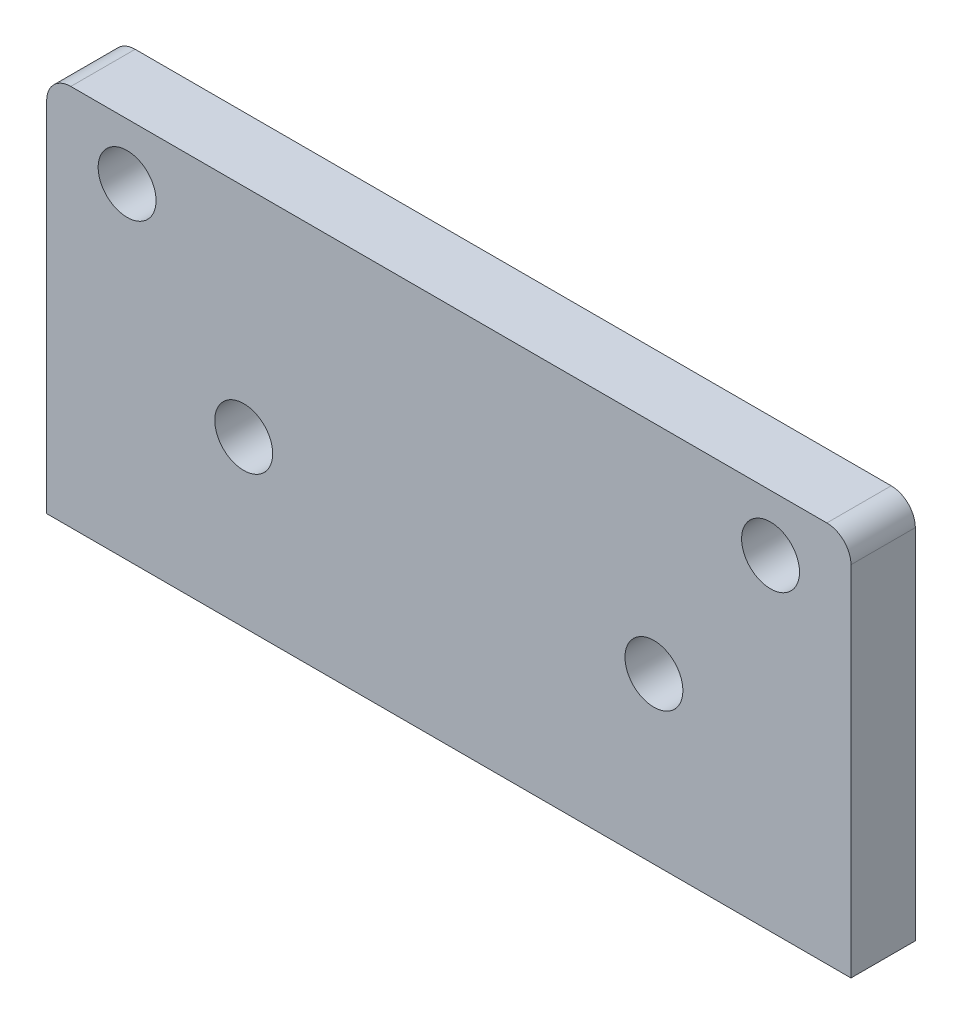
from build123d import *

# Parameters (mm, degrees)
SKETCH1_W           = 50
SKETCH1_H           = 23.75
BOSS_EXTRUDE1_DEPTH = 4
FILLET1_R           = 1.5
SKETCH2_R           = 1.8
CUT_EXTRUDE1_DEPTH  = 28.964542281


with BuildPart() as part:
    # Sketch1 → Boss-Extrude1 (new body)
    with BuildSketch(Plane.XY):
        Rectangle(SKETCH1_W, SKETCH1_H)
    extrude(amount=BOSS_EXTRUDE1_DEPTH)

    # Fillet1
    fillet1_edges = [part.edges().sort_by_distance(p)[0] for p in [
        (-25, 11.875, 2),
        (25, 11.875, 2),
    ]]
    fillet(fillet1_edges, radius=FILLET1_R)

    # Sketch2 → Cut-Extrude1 (cut, through all)
    with BuildSketch(Plane.XY.offset(4)):
        with Locations((-12.75, -1.625)):
            Circle(SKETCH2_R)
        with Locations((-20, 8.375)):
            Circle(SKETCH2_R)
        with Locations((12.75, -1.625)):
            Circle(SKETCH2_R)
        with Locations((20, 8.375)):
            Circle(SKETCH2_R)
    extrude(amount=-CUT_EXTRUDE1_DEPTH, mode=Mode.SUBTRACT)


solid = part.part
